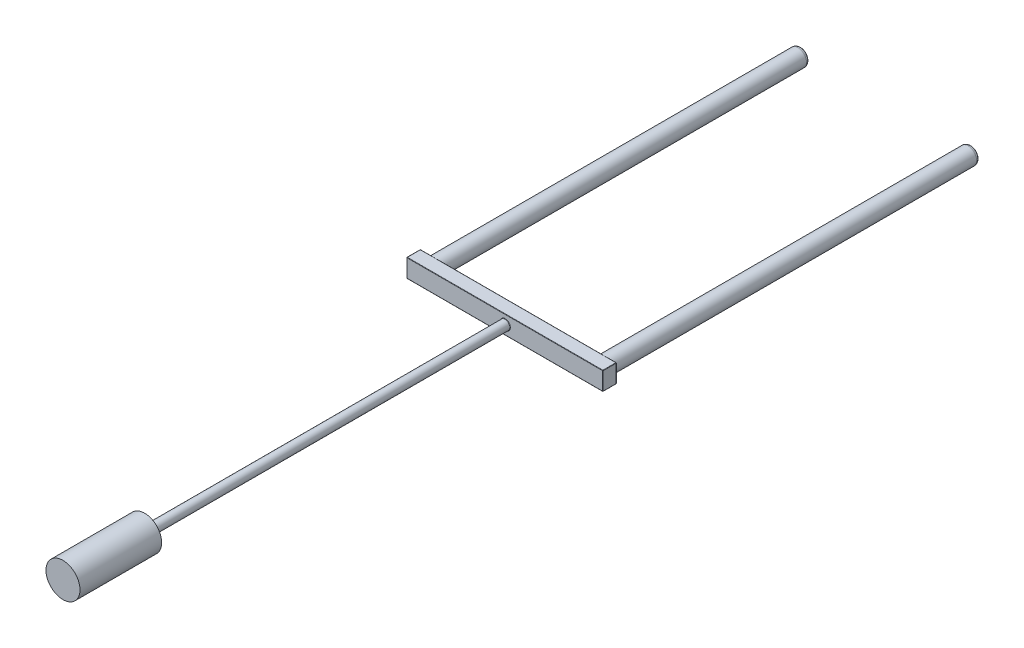
from build123d import *

# Parameters (mm, degrees)
BOSS_EXTRUDE1_DEPTH      = 500
BOSS_EXTRUDE1_DEPTH_BACK = 100
SKETCH1_R                = 7
SKETCH4_R                = 12.5
BOSS_EXTRUDE2_DEPTH      = 550
BOSS_EXTRUDE2_2_DEPTH    = 550
BOSS_EXTRUDE3_DEPTH      = 10
BOSS_EXTRUDE3_DEPTH_BACK = 10
SKETCH5_W                = 288.220289941
SKETCH5_H                = 26.942823647
FILLET4_R                = 0.5
FILLET8_R                = 0.5
FILLET9_R                = 5
BOSS_EXTRUDE4_DEPTH      = 60
BOSS_EXTRUDE4_DEPTH_BACK = 60
SKETCH6_R                = 25


with BuildPart() as part:
    # Sketch1 → Boss-Extrude1 (new, two sides: drawn at the far end of the back side and taken through both)
    with BuildSketch(Plane.XY.offset(-BOSS_EXTRUDE1_DEPTH_BACK)):
        Circle(SKETCH1_R)
    extrude(amount=BOSS_EXTRUDE1_DEPTH + BOSS_EXTRUDE1_DEPTH_BACK)



with BuildPart() as body_2:
    # Sketch4 → Boss-Extrude2 (new body)
    with BuildSketch(Plane.XY.offset(-650)):
        with Locations((-125, 0)):
            Circle(SKETCH4_R)
    extrude(amount=BOSS_EXTRUDE2_DEPTH)


with BuildPart() as body_3:
    # Sketch4 → Boss-Extrude2 2 (new body)
    with BuildSketch(Plane.XY.offset(-650)):
        with Locations((125, 0)):
            Circle(SKETCH4_R)
    extrude(amount=BOSS_EXTRUDE2_2_DEPTH)


with BuildPart() as part_1:
    add(part.part)

    add(body_2.part)  # Boss-Extrude3 merges body 2

    add(body_3.part)  # Boss-Extrude3 merges body 3
    # Sketch5 → Boss-Extrude3 (add, two sides: drawn at the far end of the back side and taken through both)
    with BuildSketch(Plane(origin=(0, 0, -100), x_dir=(-1, 0, 0), z_dir=(0, 0, -1)).offset(-BOSS_EXTRUDE3_DEPTH_BACK)):
        with Locations((0.79243599, -0.226410282)):
            Rectangle(SKETCH5_W, SKETCH5_H)
    extrude(amount=BOSS_EXTRUDE3_DEPTH + BOSS_EXTRUDE3_DEPTH_BACK)

    # Fillet4
    fillet4_edges = [part_1.edges().sort_by_distance(p)[0] for p in [
        (-7, 0, -90),
    ]]
    fillet(fillet4_edges, radius=FILLET4_R)

    # Fillet8
    fillet8_edges = [part_1.edges().sort_by_distance(p)[0] for p in [
        (-144.90258096, 13.245001541, -100),
        (-144.90258096, -0.226410283, -90),
        (-144.90258096, -13.697822106, -100),
        (-0.79243599, -13.697822106, -90),
        (143.317708981, -0.226410283, -110),
        (-0.79243599, -13.697822106, -110),
        (-144.90258096, -0.226410283, -110),
        (-0.79243599, 13.245001541, -110),
        (143.317708981, -13.697822106, -100),
        (143.317708981, -0.226410283, -90),
        (143.317708981, 13.245001541, -100),
        (-0.79243599, 13.245001541, -90),
    ]]
    fillet(fillet8_edges, radius=FILLET8_R)

    # Fillet9
    fillet9_edges = [part_1.edges().sort_by_distance(p)[0] for p in [
        (-137.5, 0, -650),
        (112.5, 0, -650),
    ]]
    fillet(fillet9_edges, radius=FILLET9_R)

    # Sketch6 → Boss-Extrude4 (add, two sides: drawn at the far end of the back side and taken through both)
    with BuildSketch(Plane.XY.offset(500).offset(-BOSS_EXTRUDE4_DEPTH_BACK)):
        Circle(SKETCH6_R)
    extrude(amount=BOSS_EXTRUDE4_DEPTH + BOSS_EXTRUDE4_DEPTH_BACK)


solid = part_1.part
